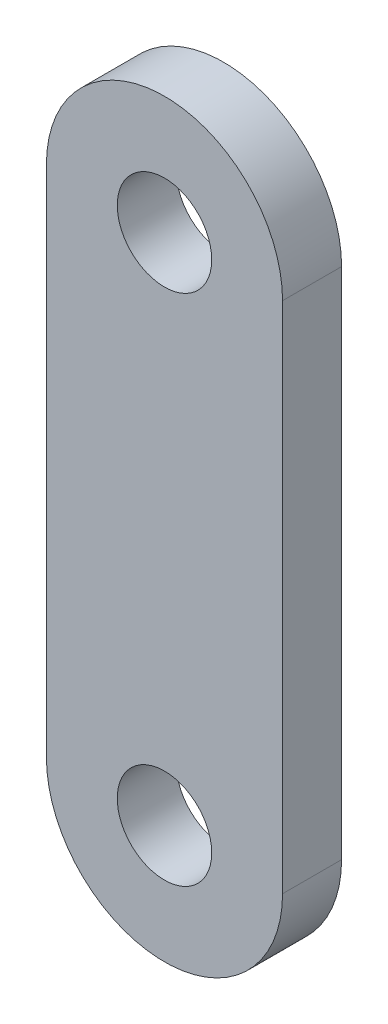
from build123d import *

# Parameters (mm, degrees)
SKETCH2_R           = 4
BOSS_EXTRUDE1_DEPTH = 5


with BuildPart() as part:
    # Sketch2 → Boss-Extrude1 (new body)
    with BuildSketch(Plane.XY):
        with BuildLine():
            Line((-10, 0), (-10, 43.5))
            ThreePointArc((-10, 43.5), (0, 53.5), (10, 43.5))
            Line((10, 43.5), (10, 0))
            ThreePointArc((10, 0), (0, -10), (-10, 0))
        make_face()
        with Locations((0, 43.5)):
            Circle(SKETCH2_R, mode=Mode.SUBTRACT)
        Circle(SKETCH2_R, mode=Mode.SUBTRACT)
    extrude(amount=BOSS_EXTRUDE1_DEPTH)


solid = part.part
